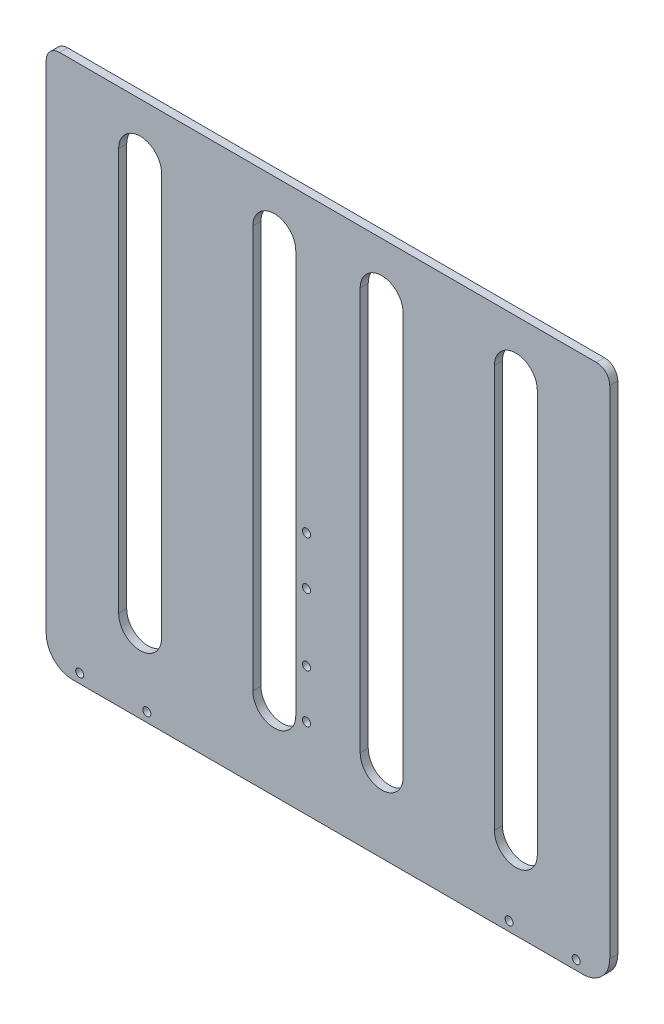
from build123d import *

# Parameters (mm, degrees)
SKETCH_1_W               = 210
SKETCH_1_H               = 200
EXTRUDE_1_DEPTH          = 3
CUT_EXTRUDE_1_DEPTH      = 291.015516826
FILLET_2_R               = 10
FILLET_3_R               = 5
CUT_EXTRUDE_2_DEPTH      = 291.015516826
CUT_EXTRUDE_2_DEPTH_BACK = 291.015516826
SKETCH_4_R               = 1.5
SKETCH_5_R               = 1.5
CUT_EXTRUDE_3_DEPTH      = 291.015516826


with BuildPart() as part:
    # 草图1 → 凸台-拉伸1 (new body)
    with BuildSketch(Plane.XY):
        with Locations((105, 100)):
            Rectangle(SKETCH_1_W, SKETCH_1_H)
    extrude(amount=EXTRUDE_1_DEPTH)

    # 草图2 → 切除-拉伸1 (cut, through all)
    with BuildSketch(Plane.XY.offset(3)):
        with BuildLine():
            Line((43, 180), (43, 30))
            ThreePointArc((43, 30), (35, 22), (27, 30))
            Line((27, 30), (27, 180))
            ThreePointArc((27, 180), (35, 188), (43, 180))
        make_face()
        with BuildLine():
            Line((167, 180), (167, 30))
            ThreePointArc((167, 30), (175, 22), (183, 30))
            Line((183, 30), (183, 180))
            ThreePointArc((183, 180), (175, 188), (167, 180))
        make_face()
        with BuildLine():
            Line((93, 180), (93, 30))
            ThreePointArc((93, 30), (85, 22), (77, 30))
            Line((77, 30), (77, 180))
            ThreePointArc((77, 180), (85, 188), (93, 180))
        make_face()
        with BuildLine():
            Line((117, 180), (117, 30))
            ThreePointArc((117, 30), (125, 22), (133, 30))
            Line((133, 30), (133, 180))
            ThreePointArc((133, 180), (125, 188), (117, 180))
        make_face()
    extrude(amount=-CUT_EXTRUDE_1_DEPTH, mode=Mode.SUBTRACT)

    # 圆角2
    fillet_2_edges = [part.edges().sort_by_distance(p)[0] for p in [
        (210, 0, 1.5),
        (0, 0, 1.5),
    ]]
    fillet(fillet_2_edges, radius=FILLET_2_R)

    # 圆角3
    fillet_3_edges = [part.edges().sort_by_distance(p)[0] for p in [
        (0, 200, 1.5),
        (210, 200, 1.5),
    ]]
    fillet(fillet_3_edges, radius=FILLET_3_R)

    # 草图4 → 切除-拉伸2 (cut, two sides: drawn at the far end of the back side and taken through both)
    with BuildSketch(Plane.XY.offset(3).offset(-CUT_EXTRUDE_2_DEPTH_BACK)):
        with Locations((12.5, 3.5)):
            Circle(SKETCH_4_R)
        with Locations((37.5, 3.5)):
            Circle(SKETCH_4_R)
        with Locations(Location((172.5, 3.5, 0), (0, 0, 180))):
            Circle(SKETCH_4_R)
        with Locations(Location((197.5, 3.5, 0), (0, 0, 180))):
            Circle(SKETCH_4_R)
    extrude(amount=CUT_EXTRUDE_2_DEPTH + CUT_EXTRUDE_2_DEPTH_BACK, mode=Mode.SUBTRACT)

    # 草图5 → 切除-拉伸3 (cut, through all)
    with BuildSketch(Plane.XY.offset(3)):
        with Locations((97, 48)):
            Circle(SKETCH_5_R)
        with Locations((97, 30)):
            Circle(SKETCH_5_R)
        with Locations((97, 73)):
            Circle(SKETCH_5_R)
        with Locations((97, 91)):
            Circle(SKETCH_5_R)
    extrude(amount=-CUT_EXTRUDE_3_DEPTH, mode=Mode.SUBTRACT)


solid = part.part
